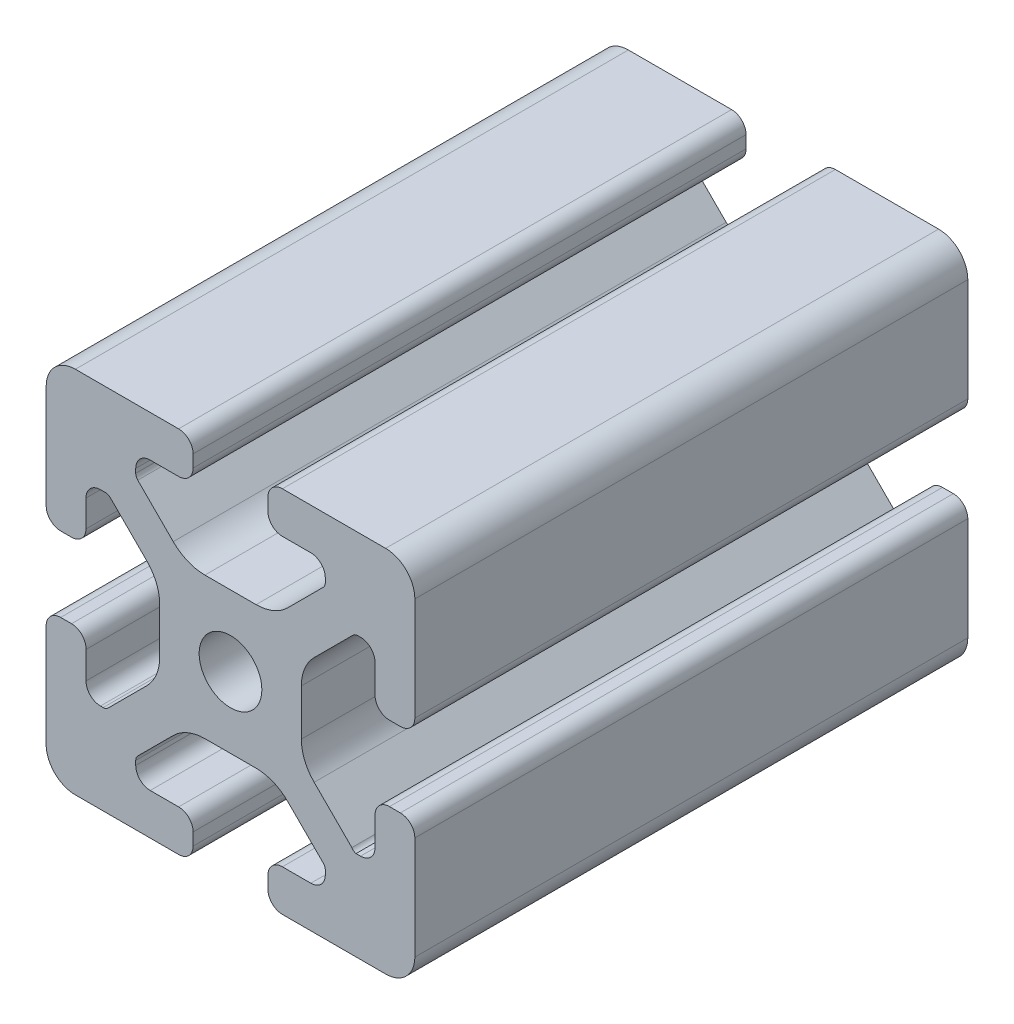
from build123d import *

# Parameters (mm, degrees)
SKETCH1_R      = 3.4
EXTRUDE1_DEPTH = 60


with BuildPart() as part:
    # Sketch1 → Extrude1 (new body)
    with BuildSketch(Plane.XY):
        with BuildLine():
            Line((-8.715, -15.524615034), (-5.63, -15.524615034))
            ThreePointArc((-5.63, -15.524615034), (-4.519842354, -15.984457388), (-4.06, -17.094615034))
            Line((-4.06, -17.094615034), (-4.06, -18.43))
            ThreePointArc((-4.06, -18.43), (-4.519842354, -19.540157646), (-5.63, -20))
            Line((-5.63, -20), (-16.674615034, -20))
            ThreePointArc((-16.674615034, -20), (-18.951578385, -19.194274381), (-20, -17.018368134))
            Line((-20, -17.018368134), (-20, -5.757918808))
            ThreePointArc((-20, -5.757918808), (-19.564709668, -4.603883664), (-18.43, -4.120449326))
            Line((-18.43, -4.120449326), (-17.25, -4.120449326))
            ThreePointArc((-17.25, -4.120449326), (-16.115287682, -4.60388249), (-15.67999625, -5.757919334))
            Line((-15.67999625, -5.757919334), (-15.67999625, -8.715399492))
            ThreePointArc((-15.67999625, -8.715399492), (-15.220153896, -9.825557139), (-14.10999625, -10.285399492))
            Line((-14.10999625, -10.285399492), (-13.816898819, -10.285399492))
            ThreePointArc((-13.816898819, -10.285399492), (-13.526061711, -10.227547119), (-13.279501941, -10.062800646))
            Line((-13.279501941, -10.062800646), (-9.076242789, -5.859541495))
            ThreePointArc((-9.076242789, -5.859541495), (-8.046572221, -4.318530588), (-7.685, -2.500784284))
            Line((-7.685, -2.500784284), (-7.685, 2.500784284))
            ThreePointArc((-7.685, 2.500784284), (-8.046572221, 4.318530588), (-9.076242789, 5.859541495))
            Line((-9.076242789, 5.859541495), (-13.040489136, 9.823787841))
            ThreePointArc((-13.040489136, 9.823787841), (-13.354224618, 10.012729352), (-13.71989919, 10.033001362))
            Line((-13.71989919, 10.033001362), (-14.05520779, 10.044710596))
            ThreePointArc((-14.05520779, 10.044710596), (-15.200613642, 9.605030484), (-15.68, 8.475666998))
            Line((-15.68, 8.475666998), (-15.68, 5.572979049))
            ThreePointArc((-15.68, 5.572979049), (-16.139842354, 4.462821403), (-17.25, 4.002979049))
            Line((-17.25, 4.002979049), (-18.43, 4.002979049))
            ThreePointArc((-18.43, 4.002979049), (-19.540157646, 4.462821403), (-20, 5.572979049))
            Line((-20, 5.572979049), (-20, 13.004526564))
            Line((-20, 13.004526564), (-20, 16.83))
            ThreePointArc((-20, 16.83), (-19.071528496, 19.071528496), (-16.83, 20))
            Line((-16.83, 20), (-5.63, 20))
            ThreePointArc((-5.63, 20), (-4.519842354, 19.540157646), (-4.06, 18.43))
            Line((-4.06, 18.43), (-4.06, 17.094615034))
            ThreePointArc((-4.06, 17.094615034), (-4.519842354, 15.984457388), (-5.63, 15.524615034))
            Line((-5.63, 15.524615034), (-8.715, 15.524615034))
            ThreePointArc((-8.715, 15.524615034), (-9.825157646, 15.06477268), (-10.285, 13.954615034))
            Line((-10.285, 13.954615034), (-10.285, 13.492503602))
            ThreePointArc((-10.285, 13.492503602), (-10.227148445, 13.201664194), (-10.062401154, 12.955102448))
            Line((-10.062401154, 12.955102448), (-6.217092793, 9.109794088))
            ThreePointArc((-6.217092793, 9.109794088), (-4.63891877, 8.055291919), (-2.777335583, 7.685))
            Line((-2.777335583, 7.685), (2.777335583, 7.685))
            ThreePointArc((2.777335583, 7.685), (4.63891877, 8.055291919), (6.217092793, 9.109794088))
            Line((6.217092793, 9.109794088), (10.062401154, 12.955102448))
            ThreePointArc((10.062401154, 12.955102448), (10.227148445, 13.201664194), (10.285, 13.492503602))
            Line((10.285, 13.492503602), (10.285, 13.954615034))
            ThreePointArc((10.285, 13.954615034), (9.825157646, 15.06477268), (8.715, 15.524615034))
            Line((8.715, 15.524615034), (5.63, 15.524615034))
            ThreePointArc((5.63, 15.524615034), (4.519842354, 15.984457388), (4.06, 17.094615034))
            Line((4.06, 17.094615034), (4.06, 18.43))
            ThreePointArc((4.06, 18.43), (4.519842354, 19.540157646), (5.63, 20))
            Line((5.63, 20), (12.979635074, 20))
            Line((12.979635074, 20), (16.83, 20))
            ThreePointArc((16.83, 20), (19.071528496, 19.071528496), (20, 16.83))
            Line((20, 16.83), (20, 13.001098436))
            Line((20, 13.001098436), (20, 5.63))
            ThreePointArc((20, 5.63), (19.540157461, 4.519842693), (18.43, 4.060000526))
            Line((18.43, 4.060000526), (17.24999625, 4.060000526))
            ThreePointArc((17.24999625, 4.060000526), (16.139838603, 4.519842879), (15.67999625, 5.630000526))
            Line((15.67999625, 5.630000526), (15.67999625, 8.715399492))
            ThreePointArc((15.67999625, 8.715399492), (15.220153896, 9.825557139), (14.10999625, 10.285399492))
            Line((14.10999625, 10.285399492), (13.816903094, 10.285399492))
            ThreePointArc((13.816903094, 10.285399492), (13.526063686, 10.227547937), (13.279501941, 10.062800646))
            Line((13.279501941, 10.062800646), (9.076242789, 5.859541495))
            ThreePointArc((9.076242789, 5.859541495), (8.046572221, 4.318530588), (7.685, 2.500784284))
            Line((7.685, 2.500784284), (7.685, -2.500784284))
            ThreePointArc((7.685, -2.500784284), (8.046572221, -4.318530588), (9.076242789, -5.859541495))
            Line((9.076242789, -5.859541495), (13.163657296, -9.946956002))
            ThreePointArc((13.163657296, -9.946956002), (13.35903797, -10.160433474), (13.6200547, -10.285399492))
            Line((13.6200547, -10.285399492), (14.10999625, -10.285399492))
            ThreePointArc((14.10999625, -10.285399492), (15.220153896, -9.825557139), (15.67999625, -8.715399492))
            Line((15.67999625, -8.715399492), (15.67999625, -5.630000526))
            ThreePointArc((15.67999625, -5.630000526), (16.139838603, -4.519842879), (17.24999625, -4.060000526))
            Line((17.24999625, -4.060000526), (18.43, -4.060000526))
            ThreePointArc((18.43, -4.060000526), (19.540157461, -4.519842693), (20, -5.63))
            Line((20, -5.63), (20, -16.83))
            ThreePointArc((20, -16.83), (19.071528496, -19.071528496), (16.83, -20))
            Line((16.83, -20), (13, -20))
            Line((13, -20), (5.63, -20))
            ThreePointArc((5.63, -20), (4.519842354, -19.540157646), (4.06, -18.43))
            Line((4.06, -18.43), (4.06, -17.094615034))
            ThreePointArc((4.06, -17.094615034), (4.519842354, -15.984457388), (5.63, -15.524615034))
            Line((5.63, -15.524615034), (8.715, -15.524615034))
            ThreePointArc((8.715, -15.524615034), (9.825157646, -15.06477268), (10.285, -13.954615034))
            Line((10.285, -13.954615034), (10.285, -13.492503602))
            ThreePointArc((10.285, -13.492503602), (10.227148445, -13.201664194), (10.062401154, -12.955102448))
            Line((10.062401154, -12.955102448), (6.217092793, -9.109794088))
            ThreePointArc((6.217092793, -9.109794088), (4.63891877, -8.055291919), (2.777335583, -7.685))
            Line((2.777335583, -7.685), (-2.777335583, -7.685))
            ThreePointArc((-2.777335583, -7.685), (-4.63891877, -8.055291919), (-6.217092793, -9.109794088))
            Line((-6.217092793, -9.109794088), (-10.062401154, -12.955102448))
            ThreePointArc((-10.062401154, -12.955102448), (-10.227148445, -13.201664194), (-10.285, -13.492503602))
            Line((-10.285, -13.492503602), (-10.285, -13.954615034))
            ThreePointArc((-10.285, -13.954615034), (-9.825157646, -15.06477268), (-8.715, -15.524615034))
        make_face()
        Circle(SKETCH1_R, mode=Mode.SUBTRACT)
    extrude(amount=-EXTRUDE1_DEPTH)


solid = part.part
